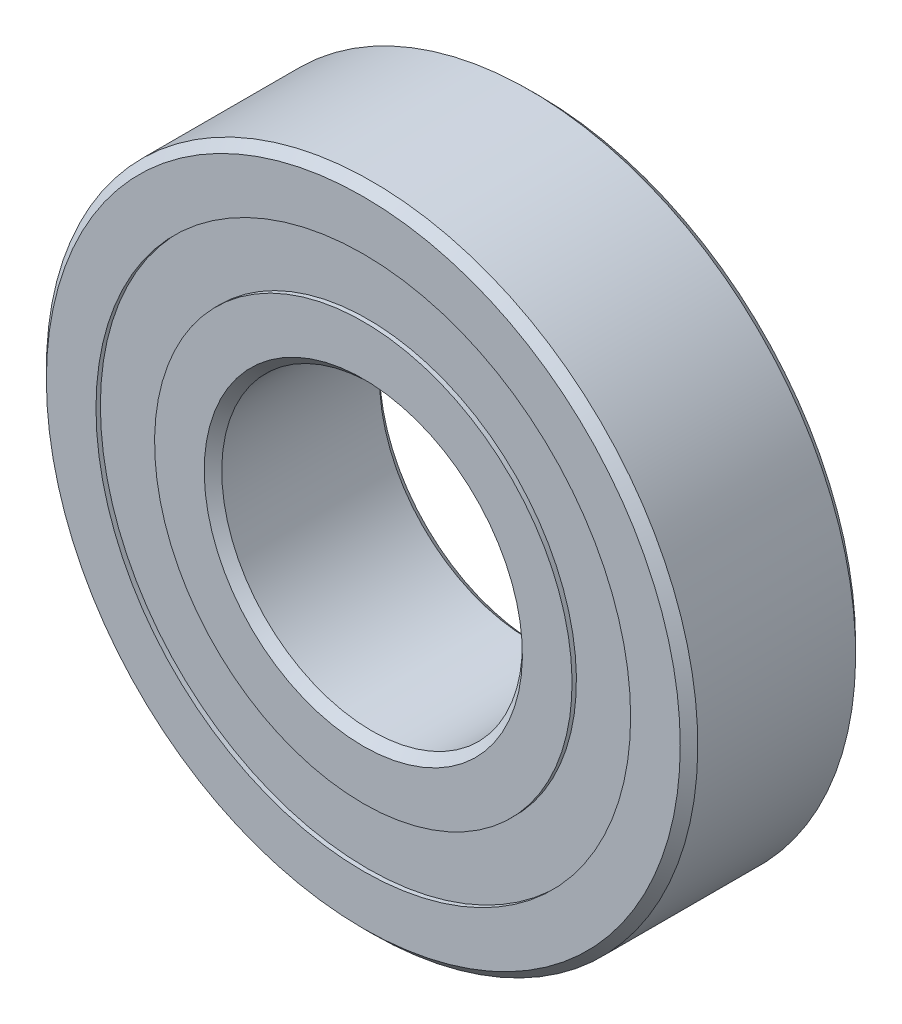
from build123d import *

# Parameters (mm, degrees)
CIRPATTERN1_COUNT = 10
SKETCH5_W         = 2.18918792
SKETCH5_H         = 3.712307692


with BuildPart() as part:
    # Sketch7 → Revolve6 (revolve)
    with BuildSketch(Plane(origin=(0, 0, 0), x_dir=(0, 0, -1), z_dir=(1, 0, 0)), mode=Mode.PRIVATE) as revolve6_sk:
        with BuildLine():
            Line((5.000625, 20.6375), (5.55625, 20.081875))
            Line((5.55625, 20.081875), (5.55625, 16.937403846))
            Line((5.55625, 16.937403846), (2.469444444, 16.937403846))
            ThreePointArc((2.469444444, 16.937403846), (0, 18.17049958), (-2.469444444, 16.937403846))
            Line((-2.469444444, 16.937403846), (-5.55625, 16.937403846))
            Line((-5.55625, 16.937403846), (-5.55625, 20.081875))
            Line((-5.55625, 20.081875), (-5.000625, 20.6375))
            Line((-5.000625, 20.6375), (5.000625, 20.6375))
        make_face()
    revolve(revolve6_sk.sketch.rotate(Axis((0, 0, 5.55625), (0, 0, -1)), 180), axis=Axis((0, 0, 5.55625), (0, 0, -1)))


with BuildPart() as body_2:
    # Sketch3 → Revolve3 (revolve)
    with BuildSketch(Plane(origin=(0, 0, 0), x_dir=(0, 0, -1), z_dir=(1, 0, 0)), mode=Mode.PRIVATE) as revolve3_sk:
        with BuildLine():
            Line((-5.000625, 9.525), (-5.55625, 10.080625))
            Line((-5.55625, 10.080625), (-5.55625, 13.225096154))
            Line((-5.55625, 13.225096154), (-2.469444444, 13.225096154))
            ThreePointArc((-2.469444444, 13.225096154), (0, 11.99200042), (2.469444444, 13.225096154))
            Line((2.469444444, 13.225096154), (5.55625, 13.225096154))
            Line((5.55625, 13.225096154), (5.55625, 10.080625))
            Line((5.55625, 10.080625), (5.000625, 9.525))
            Line((5.000625, 9.525), (-5.000625, 9.525))
        make_face()
    revolve(revolve3_sk.sketch.rotate(Axis((0, 0, 5.55625), (0, 0, -1)), 180), axis=Axis((0, 0, 5.55625), (0, 0, -1)))


with BuildPart() as body_3:
    # Sketch4 → Revolve4 (revolve)
    with BuildSketch(Plane(origin=(0, 0, 0), x_dir=(0, 0, -1), z_dir=(1, 0, 0))):
        with BuildLine():
            Line((-3.08924958, 15.08125), (3.08924958, 15.08125))
            ThreePointArc((3.08924958, 15.08125), (0, 18.17049958), (-3.08924958, 15.08125))
        make_face()
    revolve(axis=Axis((0, 15.08125, 3.08924958), (0, 0, -1)))


with BuildPart() as cirpattern1_1:
    # CirPattern1: pattern copy
    add(body_3.part.rotate(Axis((0, 0, 0), (0, 0, 1)), 1 * 360 / CIRPATTERN1_COUNT))


with BuildPart() as cirpattern1_2:
    # CirPattern1: pattern copy
    add(body_3.part.rotate(Axis((0, 0, 0), (0, 0, 1)), 2 * 360 / CIRPATTERN1_COUNT))


with BuildPart() as cirpattern1_3:
    # CirPattern1: pattern copy
    add(body_3.part.rotate(Axis((0, 0, 0), (0, 0, 1)), 3 * 360 / CIRPATTERN1_COUNT))


with BuildPart() as cirpattern1_4:
    # CirPattern1: pattern copy
    add(body_3.part.rotate(Axis((0, 0, 0), (0, 0, 1)), 4 * 360 / CIRPATTERN1_COUNT))


with BuildPart() as cirpattern1_5:
    # CirPattern1: pattern copy
    add(body_3.part.rotate(Axis((0, 0, 0), (0, 0, 1)), 5 * 360 / CIRPATTERN1_COUNT))


with BuildPart() as cirpattern1_6:
    # CirPattern1: pattern copy
    add(body_3.part.rotate(Axis((0, 0, 0), (0, 0, 1)), 6 * 360 / CIRPATTERN1_COUNT))


with BuildPart() as cirpattern1_7:
    # CirPattern1: pattern copy
    add(body_3.part.rotate(Axis((0, 0, 0), (0, 0, 1)), 7 * 360 / CIRPATTERN1_COUNT))


with BuildPart() as cirpattern1_8:
    # CirPattern1: pattern copy
    add(body_3.part.rotate(Axis((0, 0, 0), (0, 0, 1)), 8 * 360 / CIRPATTERN1_COUNT))


with BuildPart() as cirpattern1_9:
    # CirPattern1: pattern copy
    add(body_3.part.rotate(Axis((0, 0, 0), (0, 0, 1)), 9 * 360 / CIRPATTERN1_COUNT))


with BuildPart() as body_13:
    # Sketch5 → Revolve5 (revolve)
    with BuildSketch(Plane(origin=(0, 0, 0), x_dir=(0, 0, -1), z_dir=(1, 0, 0)), mode=Mode.PRIVATE) as revolve5_sk:
        with Locations((-4.18384354, 15.08125)):
            Rectangle(SKETCH5_W, SKETCH5_H)
        with Locations((4.18384354, 15.08125)):
            Rectangle(SKETCH5_W, SKETCH5_H)
    revolve(revolve5_sk.sketch.rotate(Axis((0, 0, 5.55625), (0, 0, -1)), 180), axis=Axis((0, 0, 5.55625), (0, 0, -1)))


solid = Compound([part.part, body_2.part, body_3.part, cirpattern1_1.part, cirpattern1_2.part, cirpattern1_3.part, cirpattern1_4.part, cirpattern1_5.part, cirpattern1_6.part, cirpattern1_7.part, cirpattern1_8.part, cirpattern1_9.part, body_13.part])
